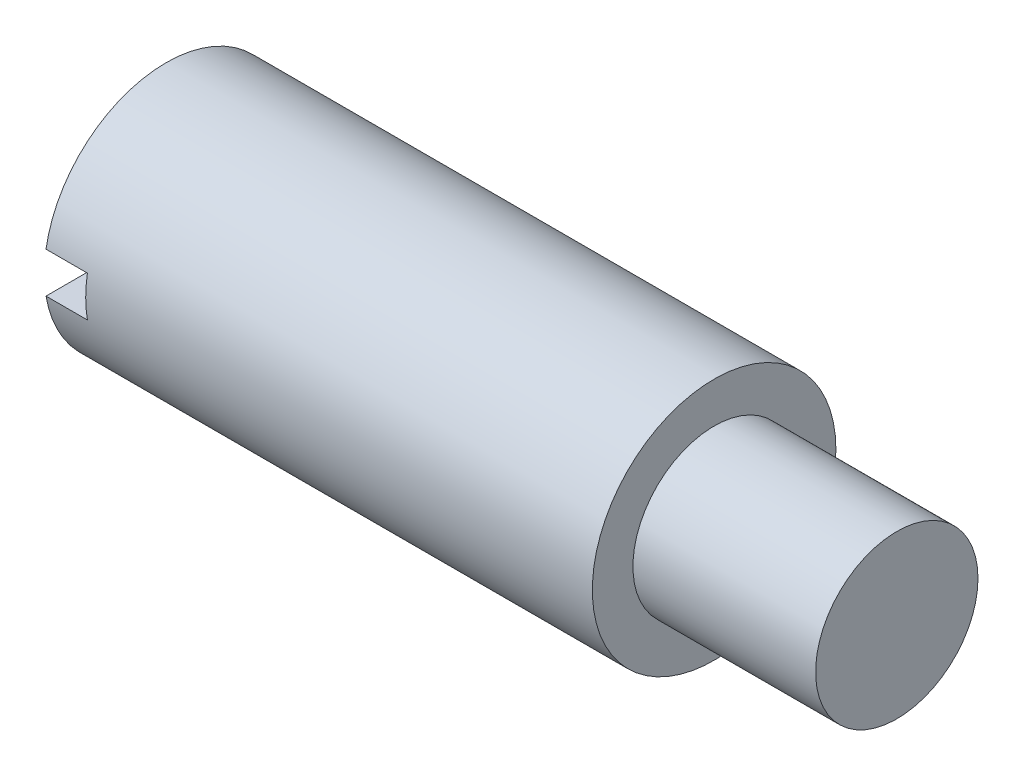
from build123d import *

# Parameters (mm, degrees)
CUT_EXTRUDE1_DEPTH      = 10.949874371
CUT_EXTRUDE1_DEPTH_BACK = 10.949874371
SKETCH2_W               = 2.04
SKETCH2_H               = 1


with BuildPart() as part:
    # Sketch1 → Revolve1 (revolve)
    with BuildSketch(Plane.XY, mode=Mode.PRIVATE) as revolve1_sk:
        Polygon((9, 0), (-9, 0), (-9, 3), (4.5, 3), (4.5, 2), (9, 2), align=None)
    revolve(revolve1_sk.sketch.rotate(Axis((9, 0, 0), (-1, 0, 0)), 90), axis=Axis((9, 0, 0), (-1, 0, 0)))

    # Sketch2 → Cut-Extrude1 (cut, two sides: drawn at the far end of the back side and taken through both)
    with BuildSketch(Plane.XY.offset(-CUT_EXTRUDE1_DEPTH_BACK)):
        with Locations((-9, 0)):
            Rectangle(SKETCH2_W, SKETCH2_H)
    extrude(amount=CUT_EXTRUDE1_DEPTH + CUT_EXTRUDE1_DEPTH_BACK, mode=Mode.SUBTRACT)


solid = part.part
